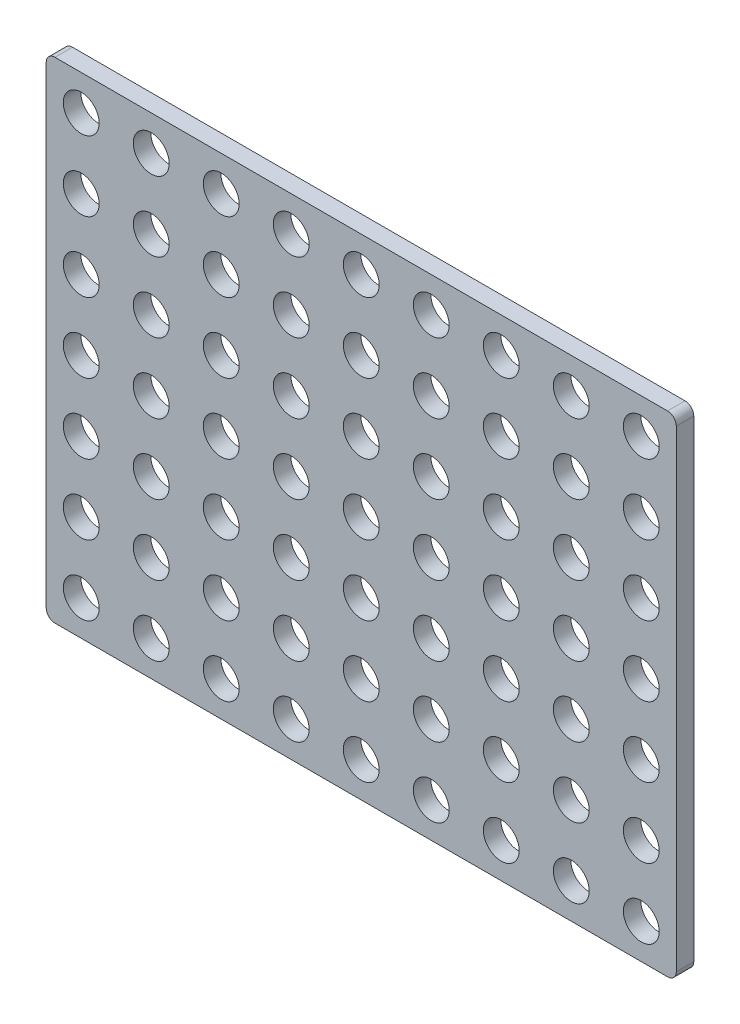
from build123d import *

# Parameters (mm, degrees)
SKETCH1_W                  = 72
SKETCH1_H                  = 56
BOSS_EXTRUDE1_DEPTH        = 2
F_4_1_4_1_DIAMETER_HOLE1_D = 4.1
LPATTERN1_COUNT            = 7
LPATTERN1_PITCH            = 8
LPATTERN1_COUNT_DIR2       = 9
LPATTERN1_PITCH_DIR2       = 8
FILLET1_R                  = 1


with BuildPart() as part:
    # Sketch1 → Boss-Extrude1 (new body)
    with BuildSketch(Plane.XY):
        with Locations((36, 28)):
            Rectangle(SKETCH1_W, SKETCH1_H)
    extrude(amount=BOSS_EXTRUDE1_DEPTH)

    # Ø4.1 (4.1) Diameter Hole1 (through all)
    with Locations(Plane.XY.offset(2)):
        with Locations((4, 4)):
            f_4_1_4_1_diameter_hole1 = Hole(F_4_1_4_1_DIAMETER_HOLE1_D / 2)

    # LPattern1: 4.1 _4.1_ Diameter Hole1 7 × 9
    with Locations(*[(j * LPATTERN1_PITCH_DIR2, i * LPATTERN1_PITCH, 0) for i in range(LPATTERN1_COUNT) for j in range(LPATTERN1_COUNT_DIR2) if (i, j) != (0, 0)]):
        add(f_4_1_4_1_diameter_hole1, mode=Mode.SUBTRACT)

    # Fillet1
    fillet1_edges = [part.edges().sort_by_distance(p)[0] for p in [
        (0, 56, 1),
        (72, 56, 1),
        (72, 0, 1),
        (0, 0, 1),
    ]]
    fillet(fillet1_edges, radius=FILLET1_R)


solid = part.part
